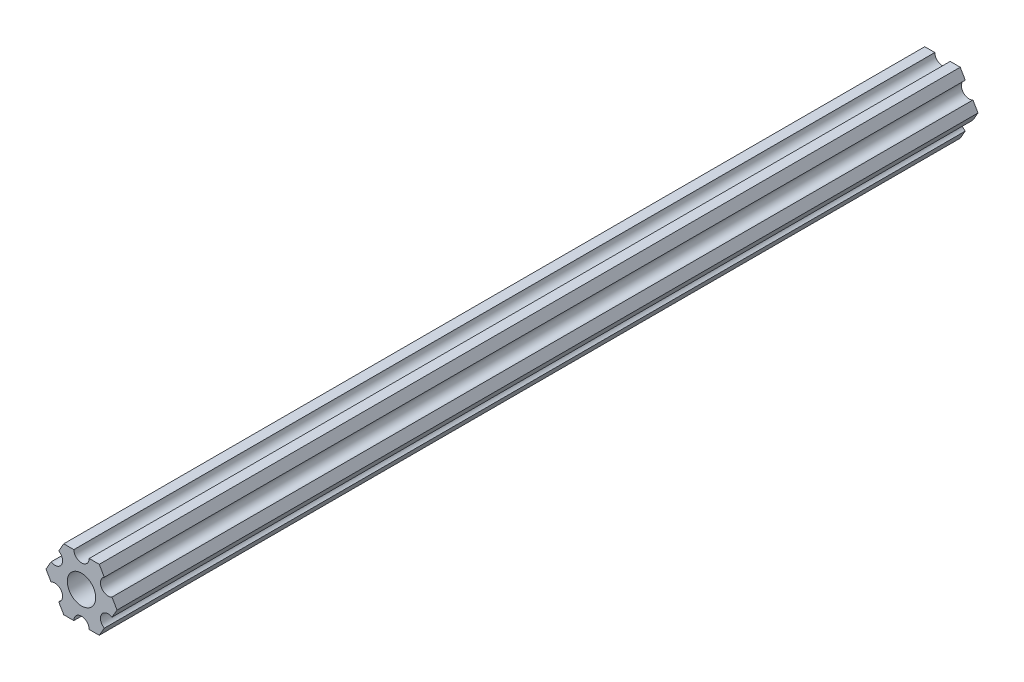
from build123d import *

# Parameters (mm, degrees)
SKETCH1_R           = 2.9337
BOSS_EXTRUDE1_DEPTH = 177.8


with BuildPart() as part:
    # Sketch1 → Boss-Extrude1 (new body)
    with BuildSketch(Plane.XY):
        with BuildLine():
            Line((-4.705511314, -4.549815329), (-3.666174209, -6.35))
            Line((-3.666174209, -6.35), (-1.5875, -6.35))
            ThreePointArc((-1.5875, -6.35), (0, -4.7625), (1.5875, -6.35))
            Line((1.5875, -6.35), (3.666174209, -6.35))
            Line((3.666174209, -6.35), (4.705511314, -4.549815329))
            ThreePointArc((4.705511314, -4.549815329), (4.124445986, -2.38125), (6.293011314, -1.800184671))
            Line((6.293011314, -1.800184671), (7.332348419, 0))
            Line((7.332348419, 0), (6.293011314, 1.800184671))
            ThreePointArc((6.293011314, 1.800184671), (4.124445986, 2.38125), (4.705511314, 4.549815329))
            Line((4.705511314, 4.549815329), (3.666174209, 6.35))
            Line((3.666174209, 6.35), (1.5875, 6.35))
            ThreePointArc((1.5875, 6.35), (0, 4.7625), (-1.5875, 6.35))
            Line((-1.5875, 6.35), (-3.666174209, 6.35))
            Line((-3.666174209, 6.35), (-4.705511314, 4.549815329))
            ThreePointArc((-4.705511314, 4.549815329), (-4.124445986, 2.38125), (-6.293011314, 1.800184671))
            Line((-6.293011314, 1.800184671), (-7.332348419, 0))
            Line((-7.332348419, 0), (-6.293011314, -1.800184671))
            ThreePointArc((-6.293011314, -1.800184671), (-4.124445986, -2.38125), (-4.705511314, -4.549815329))
        make_face()
        Circle(SKETCH1_R, mode=Mode.SUBTRACT)
    extrude(amount=BOSS_EXTRUDE1_DEPTH)


solid = part.part
